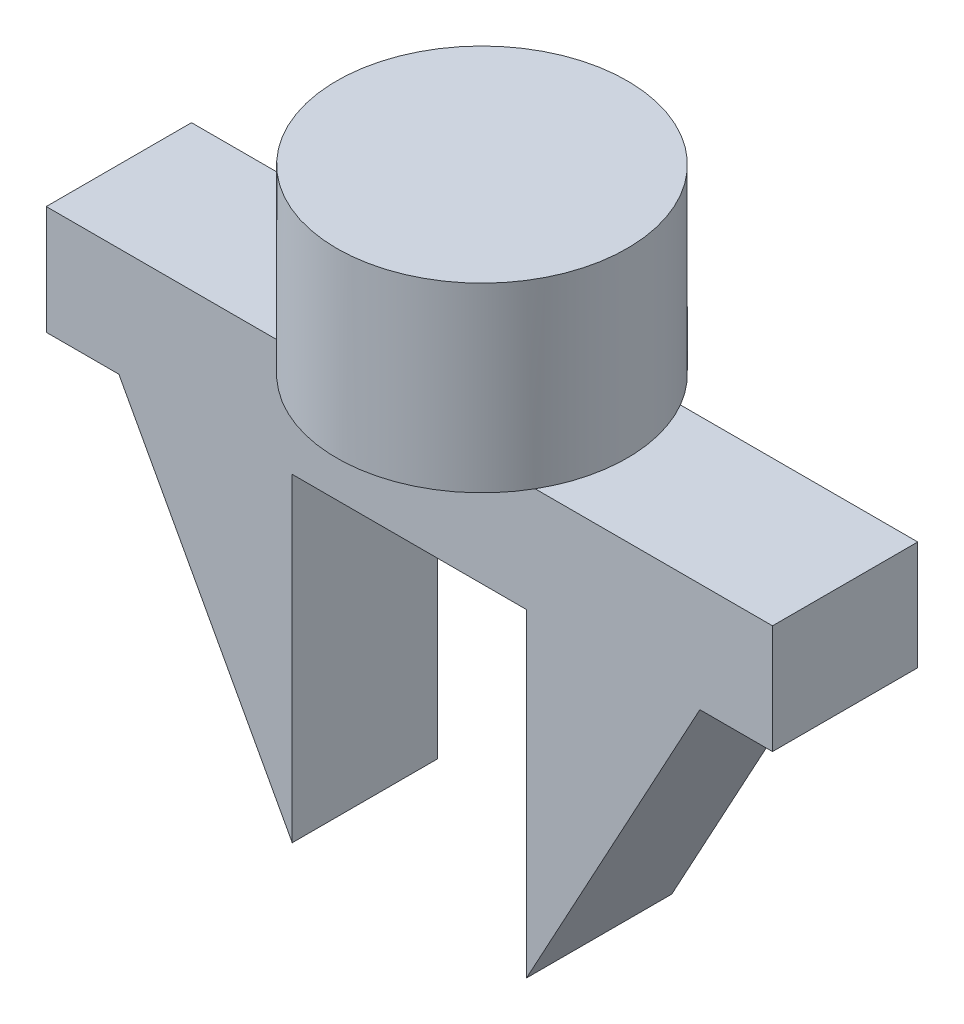
from build123d import *

# Parameters (mm, degrees)
EXTRUDE_1_DEPTH = 20
EXTRUDE_2_DEPTH = 25


with BuildPart() as part:
    # 草图3 → 凸台-拉伸1 (new body)
    with BuildSketch(Plane.XY):
        Polygon((0, -15), (0, 0), (-50, 0), (-50, -15), (-40, -15), (-16.127693207, -58.93305098), (-16.127693207, -15), align=None)
        Polygon((50, -15), (50, 0), (0, 0), (0, -15), (16.127693207, -15), (16.127693207, -58.93305098), (40, -15), align=None)
    extrude(amount=EXTRUDE_1_DEPTH)

    # 草图4 → 凸台-拉伸2 (add)
    with BuildSketch(Plane(origin=(0, 0, 0), x_dir=(1, 0, 0), z_dir=(0, 1, 0))):
        with BuildLine():
            Line((17.320508076, -20), (0, -20))
            Line((0, -20), (-17.320508076, -20))
            ThreePointArc((-17.320508076, -20), (0, -30), (17.320508076, -20))
        make_face()
        with BuildLine():
            Line((17.320508076, 0), (0, 0))
            Line((0, 0), (0, -20))
            Line((0, -20), (17.320508076, -20))
            ThreePointArc((17.320508076, -20), (19.318516526, -15.176380902), (20, -10))
            ThreePointArc((20, -10), (19.318516526, -4.823619098), (17.320508076, 0))
        make_face()
        with BuildLine():
            Line((0, -20), (0, 0))
            Line((0, 0), (-17.320508076, 0))
            ThreePointArc((-17.320508076, 0), (-20, -10), (-17.320508076, -20))
            Line((-17.320508076, -20), (0, -20))
        make_face()
        with BuildLine():
            Line((-17.320508076, 0), (0, 0))
            Line((0, 0), (17.320508076, 0))
            ThreePointArc((17.320508076, 0), (0, 10), (-17.320508076, 0))
        make_face()
    extrude(amount=EXTRUDE_2_DEPTH)


solid = part.part
